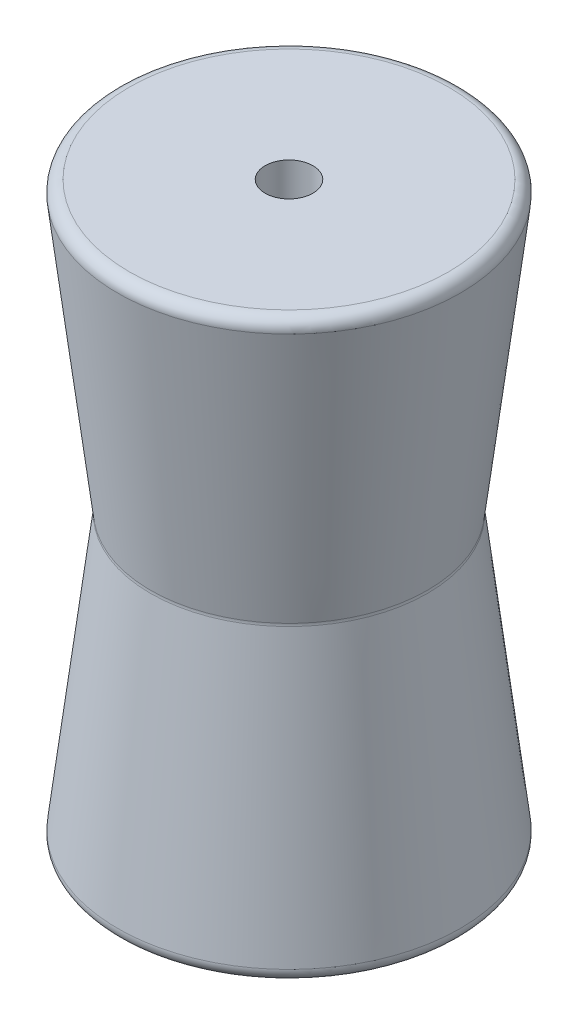
from build123d import *

# Parameters (mm, degrees)
SKETCH_3_R          = 2.075
CUT_EXTRUDE_1_DEPTH = 60
FILLET_1_R          = 1


with BuildPart() as part:
    # 草图2 → 旋转1 (revolve)
    with BuildSketch(Plane.XY, mode=Mode.PRIVATE) as revolve_1_sk:
        Polygon((0, 0), (0, 50), (-15, 50), (-12, 25), (-15, 0), align=None)
    revolve(revolve_1_sk.sketch.rotate(Axis((0, 0, 0), (0, 1, 0)), 180), axis=Axis((0, 0, 0), (0, 1, 0)))

    # 草图3 → 切除-拉伸1 (cut)
    with BuildSketch(Plane.XZ):
        with Locations(Location((0, 0, 0), (0, 0, 270))):
            Circle(SKETCH_3_R)
    extrude(amount=-CUT_EXTRUDE_1_DEPTH, mode=Mode.SUBTRACT)

    # 圆角1
    fillet_1_edges = [part.edges().sort_by_distance(p)[0] for p in [
        (-15, 50, 0),
        (-15, 0, 0),
        (-12, 25, 0),
    ]]
    fillet(fillet_1_edges, radius=FILLET_1_R)


solid = part.part
